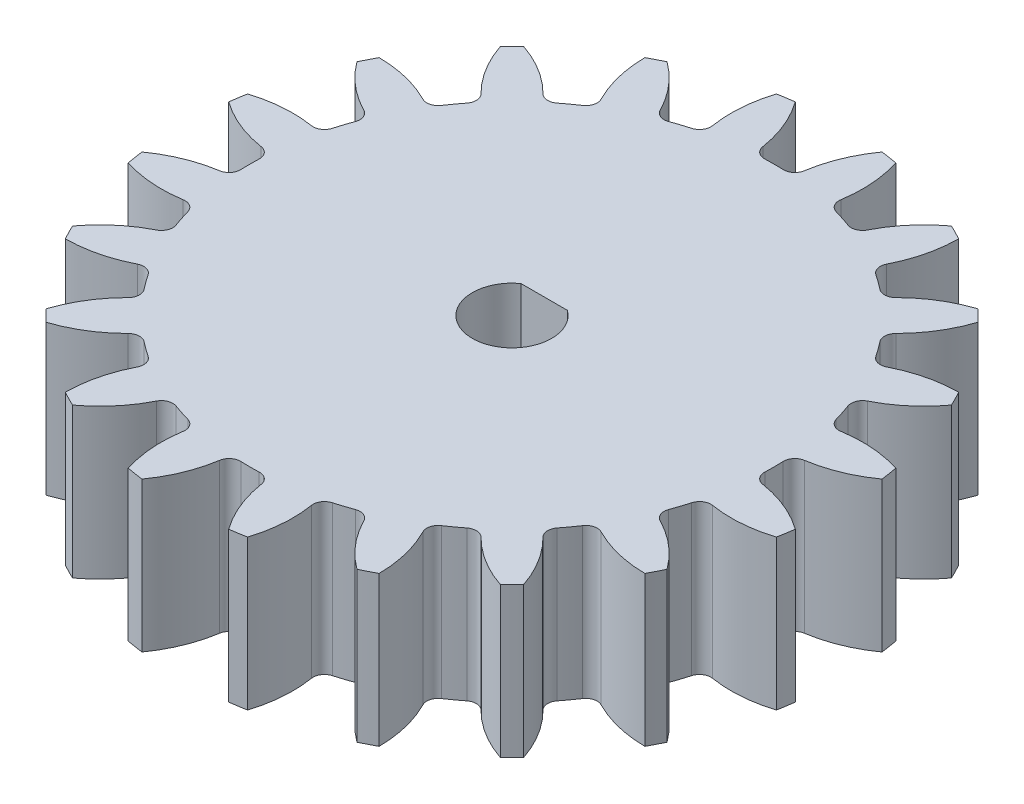
from build123d import *

# Parameters (mm, degrees)
SKETCH1_R                = 22
SKETCH1_R_2              = 2.65
BOSS_EXTRUDE1_DEPTH      = 10
CUT_EXTRUDE1_DEPTH       = 33.680269277
FILLET1_R                = 0.76
CIRPATTERN2_COUNT        = 20
FILLET1_OF_CIRPATTERN2_R = 0.76
BOSS_EXTRUDE2_DEPTH      = 10


with BuildPart() as part:
    # Sketch1 → Boss-Extrude1 (new body)
    with BuildSketch(Plane(origin=(0, 0, 0), x_dir=(1, 0, 0), z_dir=(0, 1, 0))):
        with Locations(Location((0, 0, 0), (0, 0, 270))):
            Circle(SKETCH1_R)
        with Locations(Location((0, 0, 0), (0, 0, 270))):
            Circle(SKETCH1_R_2, mode=Mode.SUBTRACT)
    extrude(amount=BOSS_EXTRUDE1_DEPTH)

    # Sketch2 → Cut-Extrude1 (cut, through all)
    with BuildSketch(Plane(origin=(0, 10, 0), x_dir=(1, 0, 0), z_dir=(0, 1, 0))):
        with BuildLine():
            ThreePointArc((1.310279948, 17.450878673), (0, 17.5), (-1.310279948, 17.450878673))
            ThreePointArc((-1.310279948, 17.450878673), (-1.802788979, 19.73907503), (-2.89632944, 21.808513837))
            ThreePointArc((-2.89632944, 21.808513837), (0, 22), (2.89632944, 21.808513837))
            ThreePointArc((2.89632944, 21.808513837), (1.802788979, 19.73907503), (1.310279948, 17.450878673))
        make_face()
    cut_extrude1 = extrude(amount=-CUT_EXTRUDE1_DEPTH, mode=Mode.SUBTRACT)

    # Fillet1
    fillet1_edges = [part.edges().sort_by_distance(p)[0] for p in [
        (-1.310279948, 5, -17.450878673),
        (1.310279948, 5, -17.450878673),
    ]]
    fillet(fillet1_edges, radius=FILLET1_R)

    # CirPattern2: Cut-Extrude1 ×20 about axis
    cirpattern2_axis = Axis((0, 0, 0), (0, 1, 0))
    for i in range(1, CIRPATTERN2_COUNT):
        add(cut_extrude1.rotate(cirpattern2_axis, i * 360 / CIRPATTERN2_COUNT), mode=Mode.SUBTRACT)

    # Fillet1 of CirPattern2
    fillet1_of_cirpattern2_edges = [part.edges().sort_by_distance(p)[0] for p in [
        (-6.63876836, 5, -16.191873106),
        (-4.146467794, 5, -17.001670648),
        (-11.317407869, 5, -13.347894183),
        (-9.197330378, 5, -14.888220643),
        (-14.888220643, 5, -9.197330378),
        (-13.347894183, 5, -11.317407869),
        (-17.001670648, 5, -4.146467794),
        (-16.191873106, 5, -6.63876836),
        (-17.450878673, 5, 1.310279948),
        (-17.450878673, 5, -1.310279948),
        (-16.191873106, 5, 6.63876836),
        (-17.001670648, 5, 4.146467794),
        (-13.347894183, 5, 11.317407869),
        (-14.888220643, 5, 9.197330378),
        (-9.197330378, 5, 14.888220643),
        (-11.317407869, 5, 13.347894183),
        (-4.146467794, 5, 17.001670648),
        (-6.63876836, 5, 16.191873106),
        (1.310279948, 5, 17.450878673),
        (-1.310279948, 5, 17.450878673),
        (6.63876836, 5, 16.191873106),
        (4.146467794, 5, 17.001670648),
        (11.317407869, 5, 13.347894183),
        (9.197330378, 5, 14.888220643),
        (14.888220643, 5, 9.197330378),
        (13.347894183, 5, 11.317407869),
        (17.001670648, 5, 4.146467794),
        (16.191873106, 5, 6.63876836),
        (17.450878673, 5, -1.310279948),
        (17.450878673, 5, 1.310279948),
        (16.191873106, 5, -6.63876836),
        (17.001670648, 5, -4.146467794),
        (13.347894183, 5, -11.317407869),
        (14.888220643, 5, -9.197330378),
        (9.197330378, 5, -14.888220643),
        (11.317407869, 5, -13.347894183),
        (4.146467794, 5, -17.001670648),
        (6.63876836, 5, -16.191873106),
    ]]
    fillet(fillet1_of_cirpattern2_edges, radius=FILLET1_OF_CIRPATTERN2_R)

    # Sketch4 → Boss-Extrude2 (add)
    with BuildSketch(Plane(origin=(0, 0, 0), x_dir=(1, 0, 0), z_dir=(0, 1, 0))):
        with BuildLine():
            Line((-1.549193338, 2.15), (1.549193338, 2.15))
            ThreePointArc((1.549193338, 2.15), (0, 2.65), (-1.549193338, 2.15))
        make_face()
    extrude(amount=BOSS_EXTRUDE2_DEPTH)


solid = part.part
